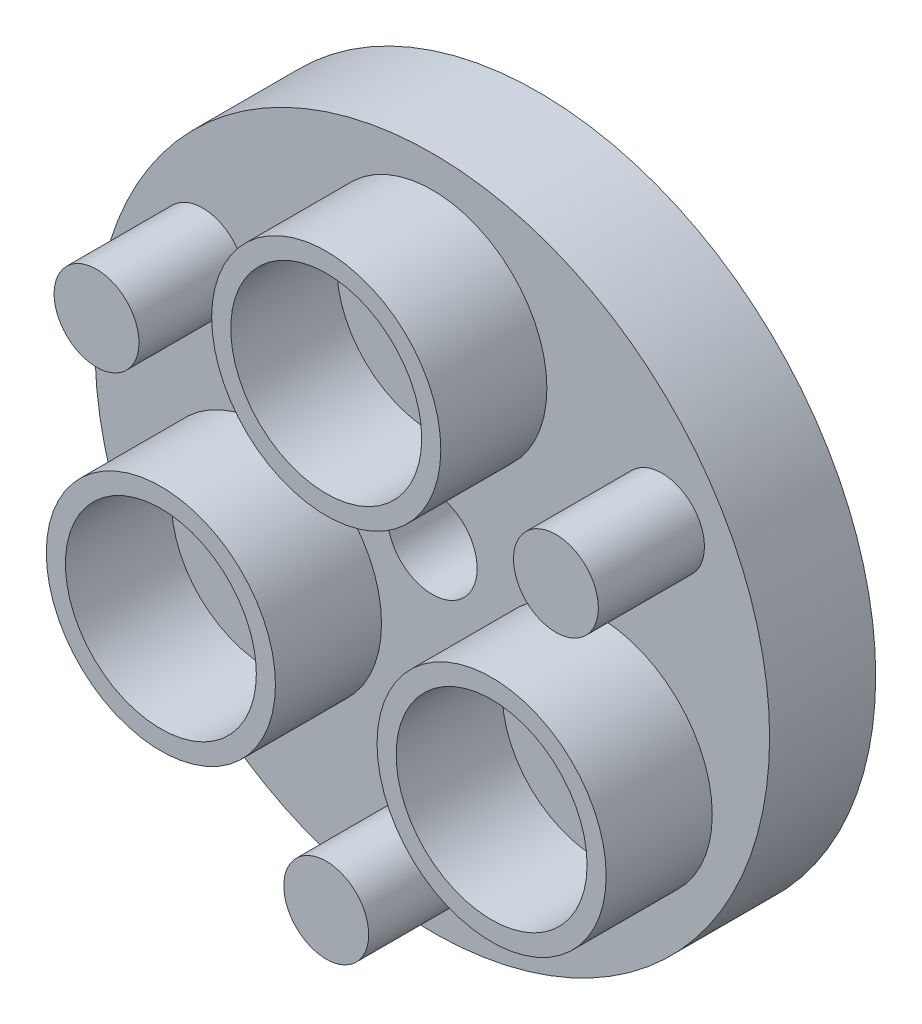
from build123d import *

# Parameters (mm, degrees)
ESQUISSE4_R             = 31.794871795
BOSS_EXTRU_1_DEPTH      = 10
ESQUISSE5_R             = 10.8
ESQUISSE5_R_2           = 9
ESQUISSE5_R_3           = 4
BOSS_EXTRU_2_DEPTH      = 10
ESQUISSE6_R             = 4
ENL_V_MAT_EXTRU_2_DEPTH = 5
ESQUISSE8_R             = 4.222540961
ENL_V_MAT_EXTRU_4_DEPTH = 10


with BuildPart() as part:
    # Esquisse4 → Boss.-Extru.1 (new body)
    with BuildSketch(Plane.XY):
        Circle(ESQUISSE4_R)
    extrude(amount=-BOSS_EXTRU_1_DEPTH)

    # Esquisse5 → Boss.-Extru.2 (add)
    # profile 1 of 6: a face of its own
    with BuildSketch(Plane.XY):
        with Locations((15.588457268, -9)):
            Circle(ESQUISSE5_R)
        with Locations((15.588457268, -9)):
            Circle(ESQUISSE5_R_2, mode=Mode.SUBTRACT)
    # profile 2 of 6: a face of its own
    with BuildSketch(Plane.XY):
        with Locations((-15.588457268, -9)):
            Circle(ESQUISSE5_R)
        with Locations((-15.588457268, -9)):
            Circle(ESQUISSE5_R_2, mode=Mode.SUBTRACT)
    # profile 3 of 6: a face of its own
    with BuildSketch(Plane.XY):
        with Locations((0, 18)):
            Circle(ESQUISSE5_R)
        with Locations((0, 18)):
            Circle(ESQUISSE5_R_2, mode=Mode.SUBTRACT)
    # profile 4 of 6: a face of its own
    with BuildSketch(Plane.XY):
        with Locations((21.650635095, 12.5)):
            Circle(ESQUISSE5_R_3)
    # profile 5 of 6: a face of its own
    with BuildSketch(Plane.XY):
        with Locations((-21.650635095, 12.5)):
            Circle(ESQUISSE5_R_3)
    # profile 6 of 6: a face of its own
    with BuildSketch(Plane.XY):
        with Locations((0, -25)):
            Circle(ESQUISSE5_R_3)
    extrude(amount=BOSS_EXTRU_2_DEPTH)

    # Esquisse6 → Enlèv. mat.-Extru.2 (cut)
    with BuildSketch(Plane(origin=(0, 0, -10), x_dir=(-1, 0, 0), z_dir=(0, 0, -1))):
        with Locations((0, 25.641025641)):
            Circle(ESQUISSE6_R)
        with Locations((22.205779584, 12.820512821)):
            Circle(ESQUISSE6_R)
        with Locations((22.205779584, -12.820512821)):
            Circle(ESQUISSE6_R)
        with Locations((0, -25.641025641)):
            Circle(ESQUISSE6_R)
        with Locations((-22.205779584, -12.820512821)):
            Circle(ESQUISSE6_R)
        with Locations((-22.205779584, 12.820512821)):
            Circle(ESQUISSE6_R)
    extrude(amount=-ENL_V_MAT_EXTRU_2_DEPTH, mode=Mode.SUBTRACT)

    # Esquisse8 → Enlèv. mat.-Extru.4 (cut)
    with BuildSketch(Plane(origin=(0, 0, -10), x_dir=(-1, 0, 0), z_dir=(0, 0, -1))):
        Circle(ESQUISSE8_R)
    extrude(amount=-ENL_V_MAT_EXTRU_4_DEPTH, mode=Mode.SUBTRACT)


solid = part.part
